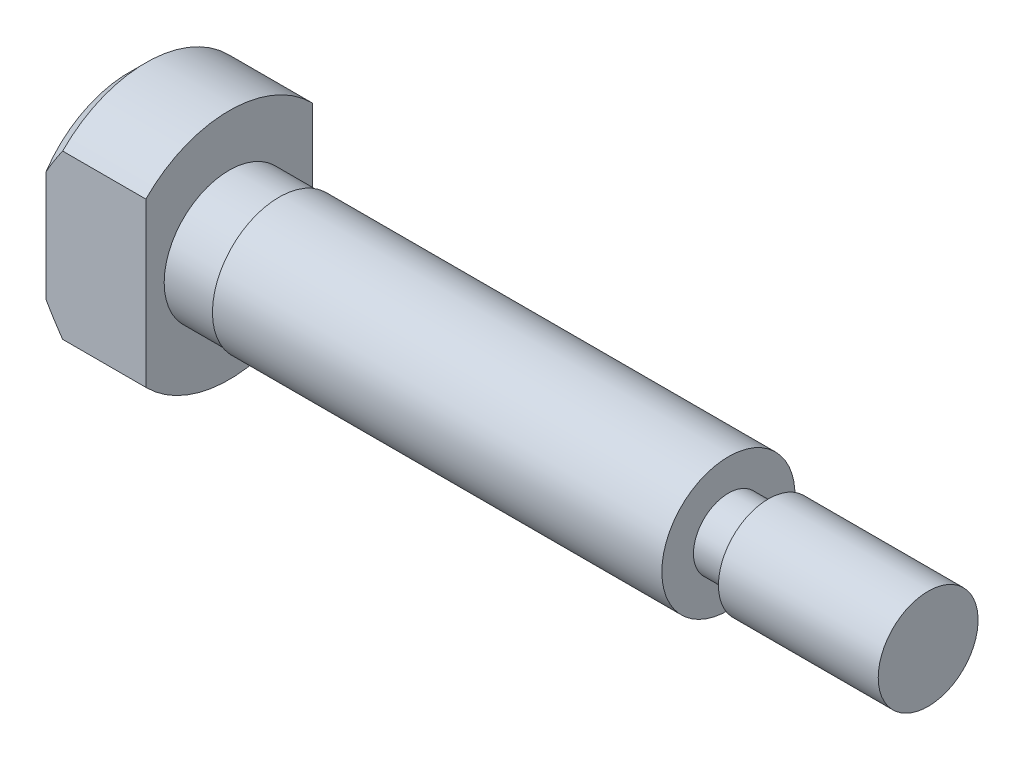
from build123d import *

# Parameters (mm, degrees)
CUT_EXTRUDE1_DEPTH      = 22.57544901
CUT_EXTRUDE1_DEPTH_BACK = 22.57544901
SKETCH2_W               = 3
SKETCH2_H               = 1
CHAMFER1_SIZE           = 0.5


with BuildPart() as part:
    # Sketch1 → Revolve1 (revolve)
    with BuildSketch(Plane.XY, mode=Mode.PRIVATE) as revolve1_sk:
        Polygon((-3, 0), (-3, 3.5), (0, 3.5), (0, 1.95), (1.5, 1.95), (1.5, 2), (15, 2), (15, 1.05), (16.2, 1.05), (16.2, 1.5), (21, 1.5), (21, 0), align=None)
    revolve(revolve1_sk.sketch.rotate(Axis((0, 0, 0), (1, 0, 0)), 90), axis=Axis((0, 0, 0), (1, 0, 0)))

    # Sketch2 → Cut-Extrude1 (cut, two sides: drawn at the far end of the back side and taken through both)
    with BuildSketch(Plane(origin=(0, 0, 0), x_dir=(1, 0, 0), z_dir=(0, 1, 0)).offset(-CUT_EXTRUDE1_DEPTH_BACK)):
        with Locations((-1.5, 3)):
            Rectangle(SKETCH2_W, SKETCH2_H)
        with Locations((-1.5, -3)):
            Rectangle(SKETCH2_W, SKETCH2_H)
    extrude(amount=CUT_EXTRUDE1_DEPTH + CUT_EXTRUDE1_DEPTH_BACK, mode=Mode.SUBTRACT)

    # Chamfer1
    chamfer1_edges = [part.edges().sort_by_distance(p)[0] for p in [
        (-3, -3.5, 0),
        (-3, 3.5, 0),
    ]]
    chamfer(chamfer1_edges, length=CHAMFER1_SIZE)


solid = part.part
